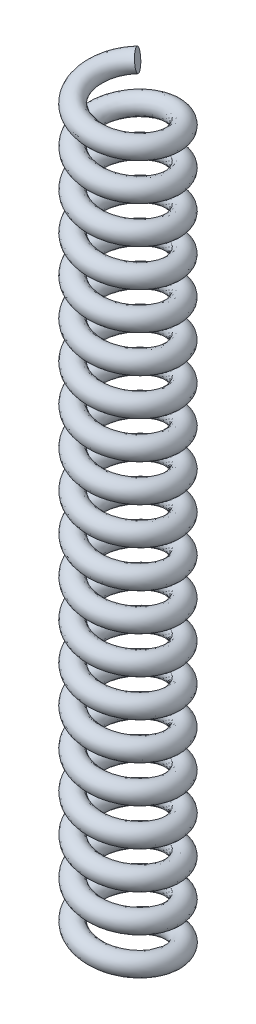
from build123d import *

# Parameters (mm, degrees)
SWEEP7_PITCH       = 9.5
SWEEP7_HEIGHT      = 190
SWEEP7_RADIUS      = 10
SWEEP7_START_ANGLE = -145
SKETCH9_R          = 2.5


with BuildPart() as part:
    # Sweep7: sweep along a helix
    with BuildLine() as sweep7_path:
        add(Helix(SWEEP7_PITCH, SWEEP7_HEIGHT, SWEEP7_RADIUS, center=(0, 0, 0), direction=(0, 1, 0), lefthand=True, mode=Mode.PRIVATE).rotate(Axis((0, 0, 0), (0, 1, 0)), SWEEP7_START_ANGLE))
    # Sketch9 → Sweep7 (sweep)
    with BuildSketch(Plane(origin=(-5.735764364, 190, -8.191520443), x_dir=(0.34513997427316834, 0.6603208359982001, 0.6669743561077555), z_dir=(0.8099464309641581, 0.14949804505154618, -0.5671305965068261))):
        Circle(SKETCH9_R)
    sweep(path=sweep7_path.line, is_frenet=True)


solid = part.part
